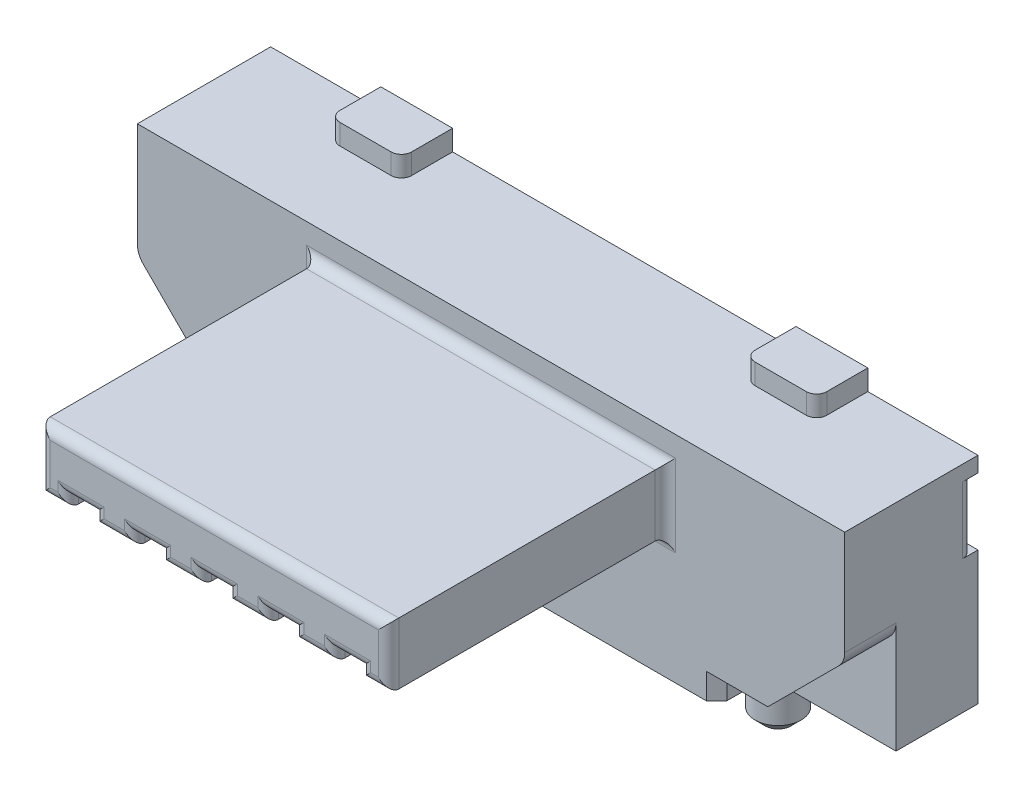
from build123d import *

# Parameters (mm, degrees)
SKETCH1_W           = 6.9
SKETCH1_H           = 1.3
BOSS_EXTRUDE1_DEPTH = 2.1
SKETCH2_W           = 3.4
SKETCH2_H           = 0.6
BOSS_EXTRUDE2_DEPTH = 2.7
SKETCH3_W           = 0.25
SKETCH3_H           = 0.1
CUT_EXTRUDE1_DEPTH  = 3
FILLET1_R           = 0.1
CUT_EXTRUDE2_DEPTH  = 0.5
FILLET3_R           = 0.2
CHAMFER1_SIZE       = 0.1
CUT_EXTRUDE3_DEPTH  = 0.05
FILLET4_R           = 0.1
SKETCH6_R           = 0.225
BOSS_EXTRUDE3_DEPTH = 0.6
CHAMFER2_SIZE       = 0.1
SKETCH7_W           = 3.4
SKETCH7_H           = 0.7
CUT_EXTRUDE4_DEPTH  = 0.3
BOSS_EXTRUDE4_DEPTH = 0.2


with BuildPart() as part:
    # Sketch1 → Boss-Extrude1 (new body)
    with BuildSketch(Plane(origin=(0, 0, 0), x_dir=(1, 0, 0), z_dir=(0, 1, 0))):
        with Locations((0, 4.15)):
            Rectangle(SKETCH1_W, SKETCH1_H)
    extrude(amount=BOSS_EXTRUDE1_DEPTH)

    # Sketch2 → Boss-Extrude2 (add)
    with BuildSketch(Plane.XY.offset(-3.5)):
        with Locations((0, 1.5)):
            Rectangle(SKETCH2_W, SKETCH2_H)
    extrude(amount=BOSS_EXTRUDE2_DEPTH)

    # Sketch3 → Cut-Extrude1 (cut)
    with BuildSketch(Plane.XY.offset(-0.8)):
        with Locations((-1.3, 1.25)):
            Rectangle(SKETCH3_W, SKETCH3_H)
        with Locations((-0.65, 1.25)):
            Rectangle(SKETCH3_W, SKETCH3_H)
        with Locations((0, 1.25)):
            Rectangle(SKETCH3_W, SKETCH3_H)
        with Locations((0.65, 1.25)):
            Rectangle(SKETCH3_W, SKETCH3_H)
        with Locations((1.3, 1.25)):
            Rectangle(SKETCH3_W, SKETCH3_H)
    extrude(amount=-CUT_EXTRUDE1_DEPTH, mode=Mode.SUBTRACT)

    # Fillet1
    fillet1_edges = [part.edges().sort_by_distance(p)[0] for p in [
        (0, 1.8, -0.8),
        (1.7, 1.5, -0.8),
        (1.5625, 1.2, -0.8),
        (-1.5625, 1.2, -0.8),
        (-1.7, 1.5, -0.8),
        (-1.7, 1.5, -3.5),
        (0, 1.8, -3.5),
        (1.7, 1.5, -3.5),
        (1.5625, 1.2, -3.5),
        (-1.5625, 1.2, -3.5),
        (0.975, 1.2, -0.8),
        (0.775, 1.25, -0.8),
        (0.65, 1.3, -0.8),
        (0.525, 1.25, -0.8),
        (0.325, 1.2, -0.8),
        (0.125, 1.25, -0.8),
        (0, 1.3, -0.8),
        (-0.125, 1.25, -0.8),
        (-0.325, 1.2, -0.8),
        (-0.525, 1.25, -0.8),
        (-0.65, 1.3, -0.8),
        (-0.775, 1.25, -0.8),
        (-0.975, 1.2, -0.8),
        (-1.175, 1.25, -0.8),
        (-1.3, 1.3, -0.8),
        (-1.425, 1.25, -0.8),
        (1.425, 1.25, -0.8),
        (1.3, 1.3, -0.8),
        (1.175, 1.25, -0.8),
        (0.975, 1.2, -3.5),
        (0.325, 1.2, -3.5),
        (-0.325, 1.2, -3.5),
        (-0.975, 1.2, -3.5),
    ]]
    fillet(fillet1_edges, radius=FILLET1_R)

    # Sketch4 → Cut-Extrude2 (cut)
    with BuildSketch(Plane.XY.offset(-3.5)):
        Polygon((-2.7, 0.25), (-3.45, 1), (-3.45, 0), (-2.2, 0), (-2.2, 0.25), align=None)
        Polygon((3.45, 1), (2.7, 0.25), (2.2, 0.25), (2.2, 0), (3.45, 0), align=None)
    extrude(amount=-CUT_EXTRUDE2_DEPTH, mode=Mode.SUBTRACT)

    # Fillet3
    fillet3_edges = [part.edges().sort_by_distance(p)[0] for p in [
        (-3.45, 1, -3.75),
        (3.45, 1, -3.75),
    ]]
    fillet(fillet3_edges, radius=FILLET3_R)

    # Chamfer1
    chamfer1_edges = [part.edges().sort_by_distance(p)[0] for p in [
        (-2.2, 0.125, -3.5),
        (2.2, 0.125, -3.5),
    ]]
    chamfer(chamfer1_edges, length=CHAMFER1_SIZE)

    # Sketch5 → Cut-Extrude3 (cut)
    with BuildSketch(Plane(origin=(0, 0, -4.8), x_dir=(-1, 0, 0), z_dir=(0, 0, -1))):
        with BuildLine():
            Line((-3.45, 1.95), (-2.25, 1.95))
            ThreePointArc((-2.25, 1.95), (-2.073223305, 1.876776695), (-2, 1.7))
            Line((-2, 1.7), (-2, 1.55))
            ThreePointArc((-2, 1.55), (-2.073223305, 1.373223305), (-2.25, 1.3))
            Line((-2.25, 1.3), (-3.45, 1.3))
            Line((-3.45, 1.3), (-3.45, 1.95))
        make_face()
        with BuildLine():
            Line((3.45, 1.95), (2.25, 1.95))
            ThreePointArc((2.25, 1.95), (2.073223305, 1.876776695), (2, 1.7))
            Line((2, 1.7), (2, 1.55))
            ThreePointArc((2, 1.55), (2.073223305, 1.373223305), (2.25, 1.3))
            Line((2.25, 1.3), (3.45, 1.3))
            Line((3.45, 1.3), (3.45, 1.95))
        make_face()
    extrude(amount=-CUT_EXTRUDE3_DEPTH, mode=Mode.SUBTRACT)

    # Fillet4
    fillet4_edges = [part.edges().sort_by_distance(p)[0] for p in [
        (3.45, 1.625, -4.75),
        (-3.45, 1.625, -4.75),
    ]]
    fillet(fillet4_edges, radius=FILLET4_R)

    # Sketch6 → Boss-Extrude3 (add)
    with BuildSketch(Plane.XZ):
        with Locations(Location((2, -4.3, 0), (0, 0, 90))):
            Circle(SKETCH6_R)
        with Locations(Location((-2, -4.3, 0), (0, 0, 90))):
            Circle(SKETCH6_R)
    extrude(amount=BOSS_EXTRUDE3_DEPTH)

    # Chamfer2
    chamfer2_edges = [part.edges().sort_by_distance(p)[0] for p in [
        (2, -0.6, -4.525),
        (-2, -0.6, -4.525),
    ]]
    chamfer(chamfer2_edges, length=CHAMFER2_SIZE)

    # Sketch7 → Cut-Extrude4 (cut)
    with BuildSketch(Plane.XZ):
        with Locations((0, -4.45)):
            Rectangle(SKETCH7_W, SKETCH7_H)
    extrude(amount=-CUT_EXTRUDE4_DEPTH, mode=Mode.SUBTRACT)

    # Sketch8 → Boss-Extrude4 (add)
    with BuildSketch(Plane(origin=(0, 2.1, 0), x_dir=(1, 0, 0), z_dir=(0, 1, 0))):
        with BuildLine():
            Line((-2.375, 4.8), (-1.675, 4.8))
            Line((-1.675, 4.8), (-1.675, 4.4))
            ThreePointArc((-1.675, 4.4), (-1.704289322, 4.329289322), (-1.775, 4.3))
            Line((-1.775, 4.3), (-2.275, 4.3))
            ThreePointArc((-2.275, 4.3), (-2.345710678, 4.329289322), (-2.375, 4.4))
            Line((-2.375, 4.4), (-2.375, 4.8))
        make_face()
        with BuildLine():
            Line((1.675, 4.8), (2.375, 4.8))
            Line((2.375, 4.8), (2.375, 4.4))
            ThreePointArc((2.375, 4.4), (2.345710678, 4.329289322), (2.275, 4.3))
            Line((2.275, 4.3), (1.775, 4.3))
            ThreePointArc((1.775, 4.3), (1.704289322, 4.329289322), (1.675, 4.4))
            Line((1.675, 4.4), (1.675, 4.8))
        make_face()
    extrude(amount=BOSS_EXTRUDE4_DEPTH)


solid = part.part
